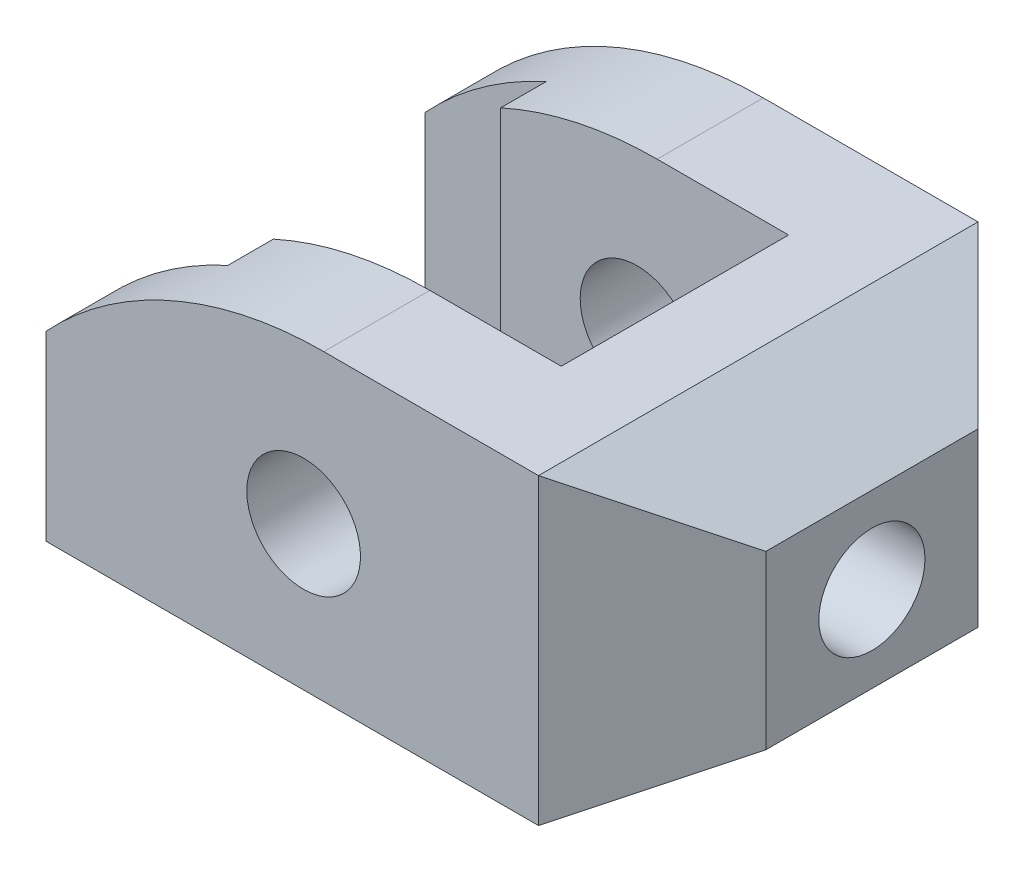
from build123d import *

# Parameters (mm, degrees)
SKETCH1_R               = 7.5
BOSS_EXTRUDE1_DEPTH     = 29
CUT_EXTRUDE1_DEPTH      = 72
CUT_EXTRUDE1_DEPTH_BACK = 95.026591983
CUT_EXTRUDE2_DEPTH      = 72
CUT_EXTRUDE3_DEPTH      = 95.026591983
CUT_EXTRUDE3_DEPTH_BACK = 95.026591983
SKETCH4_R               = 7


with BuildPart() as part:
    # Sketch1 → Boss-Extrude1 (new, symmetric)
    with BuildSketch(Plane.XY):
        with BuildLine():
            Line((0, 0), (65, 0))
            Line((65, 0), (80, 8.660254038))
            Line((80, 8.660254038), (80, 31.339745962))
            Line((80, 31.339745962), (65, 40))
            Line((65, 40), (36.66060556, 40))
            ThreePointArc((36.66060556, 40), (16.66060556, 35.82575695), (0, 24))
            Line((0, 24), (0, 0))
        make_face()
        with Locations(Location((34, 19, 0), (0, 0, 180))):
            Circle(SKETCH1_R, mode=Mode.SUBTRACT)
    extrude(amount=BOSS_EXTRUDE1_DEPTH, both=True)

    # Sketch2 → Cut-Extrude1 (cut, two sides: drawn at the far end of the back side and taken through both)
    with BuildSketch(Plane(origin=(0, 0, 0), x_dir=(1, 0, 0), z_dir=(0, 1, 0)).offset(-CUT_EXTRUDE1_DEPTH_BACK)):
        Polygon((0, 21), (16, 21), (16, 15), (54, 15), (54, -15), (16, -15), (16, -21), (0, -21), align=None)
    extrude(amount=CUT_EXTRUDE1_DEPTH + CUT_EXTRUDE1_DEPTH_BACK, mode=Mode.SUBTRACT)

    # Sketch3 → Cut-Extrude2 (cut)
    with BuildSketch(Plane(origin=(0, 0, 0), x_dir=(1, 0, 0), z_dir=(0, 1, 0))):
        Polygon((80, 29), (65, 29), (80, 14), align=None)
        Polygon((65, -29), (80, -14), (80, -29), align=None)
    extrude(amount=CUT_EXTRUDE2_DEPTH, mode=Mode.SUBTRACT)

    # Sketch4 → Cut-Extrude3 (cut, two sides: drawn at the far end of the back side and taken through both)
    with BuildSketch(Plane(origin=(80, 0, 0), x_dir=(0, 0, -1), z_dir=(1, 0, 0)).offset(-CUT_EXTRUDE3_DEPTH_BACK)):
        with Locations((0, 20)):
            Circle(SKETCH4_R)
    extrude(amount=CUT_EXTRUDE3_DEPTH + CUT_EXTRUDE3_DEPTH_BACK, mode=Mode.SUBTRACT)


solid = part.part
